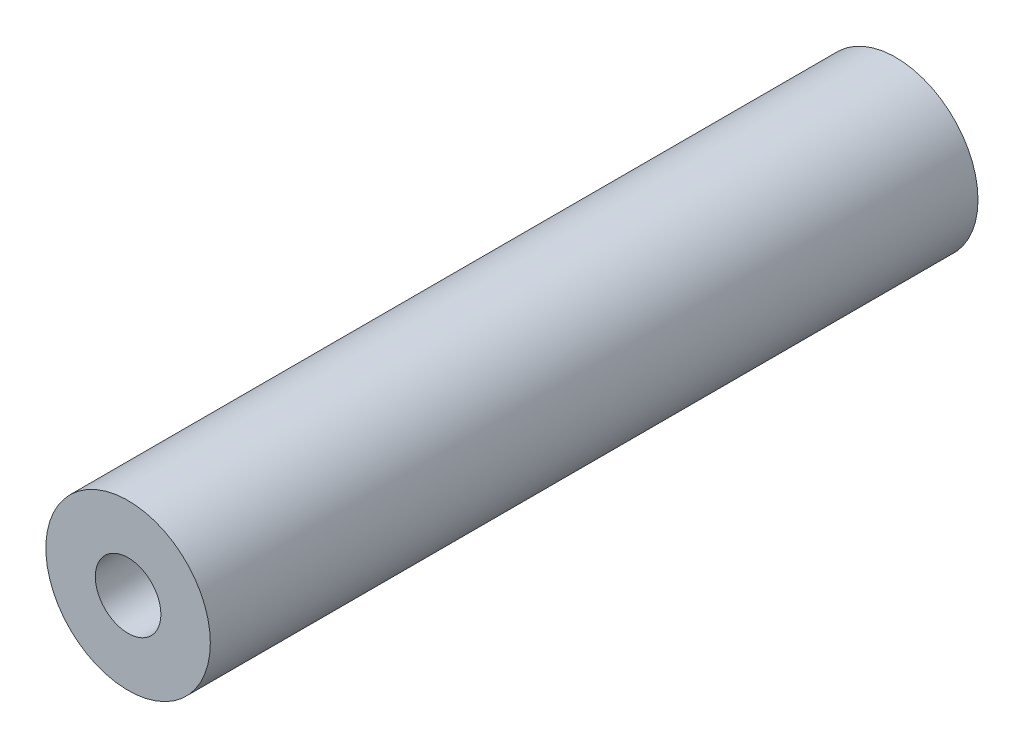
from build123d import *

# Parameters (mm, degrees)
SKETCH1_R                            = 4.7625
BOSS_EXTRUDE1_DEPTH                  = 22.225
F_10_24_TAPPED_HOLE1_D               = 3.7973
F_10_24_TAPPED_HOLE1_DEPTH           = 12.954
F_10_24_TAPPED_HOLE1_TIP             = 1.140824014
F_10_24_TAPPED_HOLE1_ON_FACE_2_D     = 3.7973
F_10_24_TAPPED_HOLE1_ON_FACE_2_DEPTH = 12.954
F_10_24_TAPPED_HOLE1_ON_FACE_2_TIP   = 1.140824014


with BuildPart() as part:
    # Sketch1 → Boss-Extrude1 (new, symmetric)
    with BuildSketch(Plane.XY):
        Circle(SKETCH1_R)
    extrude(amount=BOSS_EXTRUDE1_DEPTH, both=True)

    # #10-24 Tapped Hole1
    with Locations(Plane.XY.offset(22.225)):
        with Locations((0, 0)):
            Hole(F_10_24_TAPPED_HOLE1_D / 2, depth=F_10_24_TAPPED_HOLE1_DEPTH)
            with Locations((0, 0, -(F_10_24_TAPPED_HOLE1_DEPTH + F_10_24_TAPPED_HOLE1_TIP / 2))):  # 118° drill point
                Cone(0, F_10_24_TAPPED_HOLE1_D / 2, F_10_24_TAPPED_HOLE1_TIP, mode=Mode.SUBTRACT)

    # #10-24 Tapped Hole1 on face 2
    with Locations(Plane(origin=(0, 0, -22.225), x_dir=(-1, 0, 0), z_dir=(0, 0, -1))):
        with Locations((0, 0)):
            Hole(F_10_24_TAPPED_HOLE1_ON_FACE_2_D / 2, depth=F_10_24_TAPPED_HOLE1_ON_FACE_2_DEPTH)
            with Locations((0, 0, -(F_10_24_TAPPED_HOLE1_ON_FACE_2_DEPTH + F_10_24_TAPPED_HOLE1_ON_FACE_2_TIP / 2))):  # 118° drill point
                Cone(0, F_10_24_TAPPED_HOLE1_ON_FACE_2_D / 2, F_10_24_TAPPED_HOLE1_ON_FACE_2_TIP, mode=Mode.SUBTRACT)


solid = part.part
